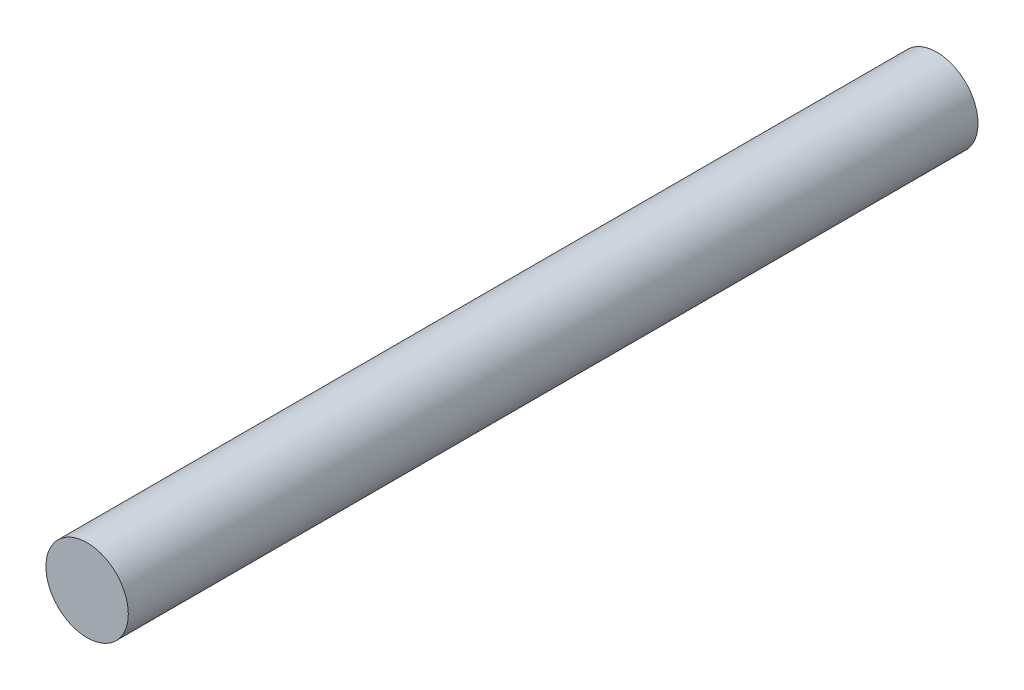
from build123d import *

# Parameters (mm, degrees)
SKETCH1_R           = 4.064
BOSS_EXTRUDE1_DEPTH = 83.82


with BuildPart() as part:
    # Sketch1 → Boss-Extrude1 (new body)
    with BuildSketch(Plane.XY):
        Circle(SKETCH1_R)
    extrude(amount=BOSS_EXTRUDE1_DEPTH)


solid = part.part
